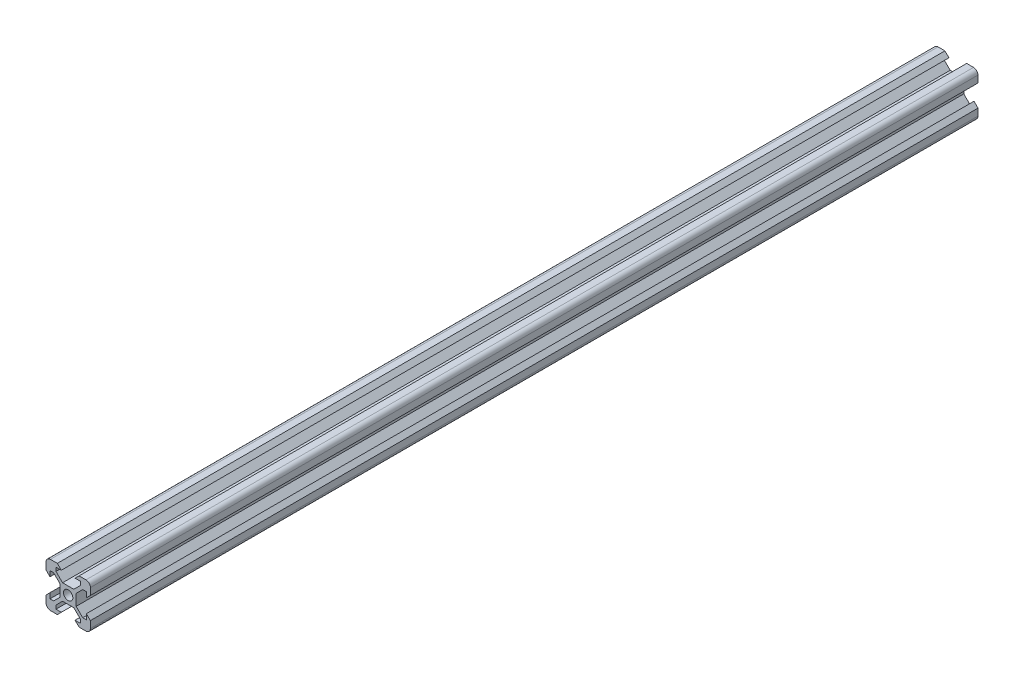
from build123d import *

# Parameters (mm, degrees)
SKETCH1_R           = 2.1
BOSS_EXTRUDE1_DEPTH = 400


with BuildPart() as part:
    # Sketch1 → Boss-Extrude1 (new body)
    with BuildSketch(Plane.XY):
        with BuildLine():
            Line((-4.9, -10), (-3.1, -8.2))
            Line((-3.1, -8.2), (-5.5, -8.2))
            Line((-5.5, -8.2), (-5.5, -6.560660172))
            Line((-5.5, -6.560660172), (-2.539339828, -3.6))
            Line((-2.539339828, -3.6), (2.539339828, -3.6))
            Line((2.539339828, -3.6), (5.5, -6.560660172))
            Line((5.5, -6.560660172), (5.5, -8.2))
            Line((5.5, -8.2), (3.1, -8.2))
            Line((3.1, -8.2), (4.9, -10))
            Line((4.9, -10), (8, -10))
            ThreePointArc((8, -10), (9.414213562, -9.414213562), (10, -8))
            Line((10, -8), (10, -4.9))
            Line((10, -4.9), (8.2, -3.1))
            Line((8.2, -3.1), (8.2, -5.5))
            Line((8.2, -5.5), (6.560660172, -5.5))
            Line((6.560660172, -5.5), (3.6, -2.539339828))
            Line((3.6, -2.539339828), (3.6, 2.539339828))
            Line((3.6, 2.539339828), (6.560660172, 5.5))
            Line((6.560660172, 5.5), (8.2, 5.5))
            Line((8.2, 5.5), (8.2, 3.1))
            Line((8.2, 3.1), (10, 4.9))
            Line((10, 4.9), (10, 8))
            ThreePointArc((10, 8), (9.414213562, 9.414213562), (8, 10))
            Line((8, 10), (4.9, 10))
            Line((4.9, 10), (3.1, 8.2))
            Line((3.1, 8.2), (5.5, 8.2))
            Line((5.5, 8.2), (5.5, 6.560660172))
            Line((5.5, 6.560660172), (2.539339828, 3.6))
            Line((2.539339828, 3.6), (-2.539339828, 3.6))
            Line((-2.539339828, 3.6), (-5.5, 6.560660172))
            Line((-5.5, 6.560660172), (-5.5, 8.2))
            Line((-5.5, 8.2), (-3.1, 8.2))
            Line((-3.1, 8.2), (-4.9, 10))
            Line((-4.9, 10), (-8, 10))
            ThreePointArc((-8, 10), (-9.414213562, 9.414213562), (-10, 8))
            Line((-10, 8), (-10, 4.9))
            Line((-10, 4.9), (-8.2, 3.1))
            Line((-8.2, 3.1), (-8.2, 5.5))
            Line((-8.2, 5.5), (-6.560660172, 5.5))
            Line((-6.560660172, 5.5), (-3.6, 2.539339828))
            Line((-3.6, 2.539339828), (-3.6, -2.539339828))
            Line((-3.6, -2.539339828), (-6.560660172, -5.5))
            Line((-6.560660172, -5.5), (-8.2, -5.5))
            Line((-8.2, -5.5), (-8.2, -3.1))
            Line((-8.2, -3.1), (-10, -4.9))
            Line((-10, -4.9), (-10, -8))
            ThreePointArc((-10, -8), (-9.414213562, -9.414213562), (-8, -10))
            Line((-8, -10), (-4.9, -10))
        make_face()
        Circle(SKETCH1_R, mode=Mode.SUBTRACT)
    extrude(amount=BOSS_EXTRUDE1_DEPTH)


solid = part.part
